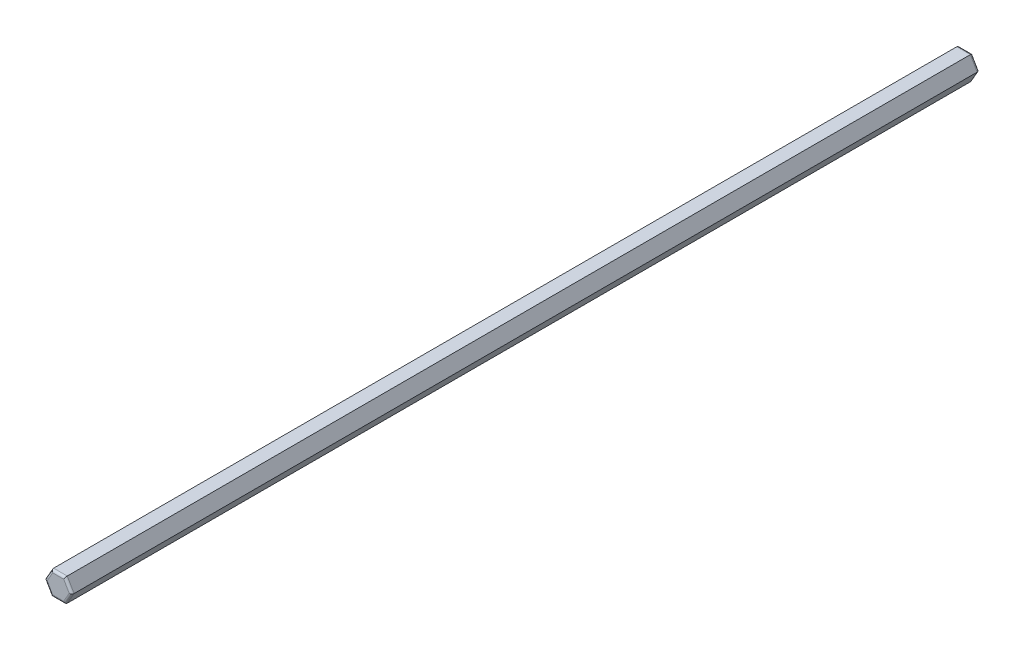
from build123d import *

# Parameters (mm, degrees)
RESSALTO_EXTRUS_O1_DEPTH = 50
FILETE1_R                = 0.25


with BuildPart() as part:
    # Esboço1 → Ressalto-extrusão1 (new, symmetric)
    with BuildSketch(Plane(origin=(0, 0, -50), x_dir=(-1, 0, 0), z_dir=(0, 0, -1))):
        Polygon((0.75, -1.299038106), (1.5, 0), (0.75, 1.299038106), (-0.75, 1.299038106), (-1.5, 0), (-0.75, -1.299038106), align=None)
    extrude(amount=RESSALTO_EXTRUS_O1_DEPTH, both=True)

    # Filete1
    filete1_edges = [part.edges().sort_by_distance(p)[0] for p in [
        (-1.125, 0.649519053, 0),
        (0, 1.299038106, 0),
        (1.125, 0.649519053, 0),
        (1.125, -0.649519053, 0),
        (0, -1.299038106, 0),
        (1.125, -0.649519053, -100),
        (1.125, 0.649519053, -100),
        (0, 1.299038106, -100),
        (-1.125, -0.649519053, 0),
        (-1.125, 0.649519053, -100),
        (-1.125, -0.649519053, -100),
        (0, -1.299038106, -100),
    ]]
    fillet(filete1_edges, radius=FILETE1_R)


solid = part.part
